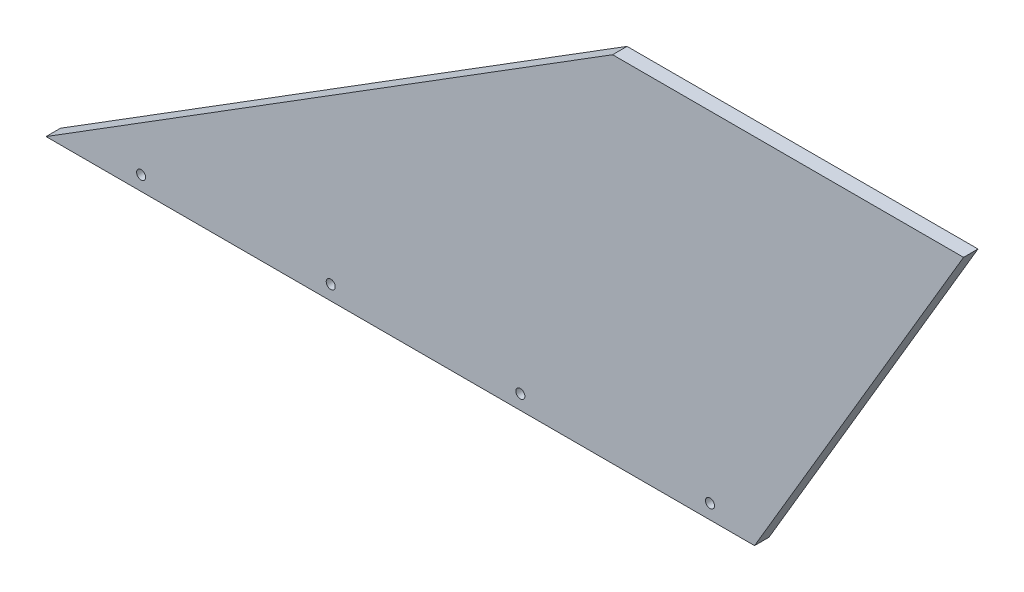
from build123d import *

# Parameters (mm, degrees)
BOSS_EXTRUDE1_DEPTH = 3.048
HOLE1_D             = 3.81
HOLE1_DEPTH         = 15.24
LPATTERN1_COUNT     = 4
LPATTERN1_PITCH     = 80.01


with BuildPart() as part:
    # Sketch1 → Boss-Extrude1 (new, symmetric)
    with BuildSketch(Plane.XY):
        Polygon((-59.885399579, 149.447165674), (-298.958, 0), (0, 0), (88.196600421, 149.447165674), align=None)
    extrude(amount=BOSS_EXTRUDE1_DEPTH, both=True)

    # Hole1
    with Locations(Plane.XY.offset(3.048)):
        with Locations((-258.826, 6.096)):
            hole1 = Hole(HOLE1_D / 2, depth=HOLE1_DEPTH)

    # LPattern1: Hole1 ×4
    with Locations(*[(i * LPATTERN1_PITCH, 0, 0) for i in range(1, LPATTERN1_COUNT)]):
        add(hole1, mode=Mode.SUBTRACT)


solid = part.part
